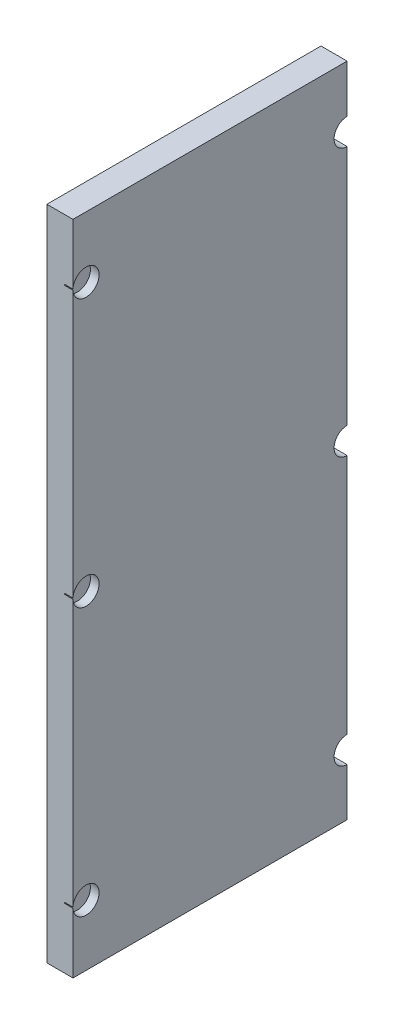
from build123d import *

# Parameters (mm, degrees)
SKETCH_1_W                                     = 3
SKETCH_1_H                                     = 74
EXTRUDE_1_DEPTH                                = 31.5
SKETCH_2_W                                     = 3
SKETCH_2_H                                     = 1.5
SIDE_REAR_EXTENSION_1P5MM_DEPTH                = 31.5
SKETCH_3_R                                     = 1.5
SIDE_TOP_EDGE_MAGNET_POCKETS_D3_DEPTH1_3_DEPTH = 1
SIDE_BOTTOM_EDGE_SEMICIRCLES_D3_THROUGH_DEPTH  = 4


with BuildPart() as part:
    # Эскиз1 → Бобышка-Вытянуть1 (new body)
    with BuildSketch(Plane.XY):
        with Locations((1.5, 37)):
            Rectangle(SKETCH_1_W, SKETCH_1_H)
    extrude(amount=EXTRUDE_1_DEPTH)

    # Эскиз2 → side_rear_extension_1p5mm (add)
    with BuildSketch(Plane.XY):
        with Locations((1.5, 74.75)):
            Rectangle(SKETCH_2_W, SKETCH_2_H)
    extrude(amount=SIDE_REAR_EXTENSION_1P5MM_DEPTH)

    # Эскиз3 → side_top_edge_magnet_pockets_D3_depth1_3x (cut)
    with BuildSketch(Plane(origin=(3, 0, 0), x_dir=(0, 0, -1), z_dir=(1, 0, 0))):
        with Locations((-30.001, 7)):
            Circle(SKETCH_3_R)
        with Locations((-30.001, 37.75)):
            Circle(SKETCH_3_R)
        with Locations((-30.001, 68.5)):
            Circle(SKETCH_3_R)
    extrude(amount=-SIDE_TOP_EDGE_MAGNET_POCKETS_D3_DEPTH1_3_DEPTH, mode=Mode.SUBTRACT)

    # Эскиз4 → side_bottom_edge_semicircles_D3_through_3x (cut)
    with BuildSketch(Plane.ZY):
        with BuildLine():
            Line((0, 5.5), (0, 8.5))
            ThreePointArc((0, 8.5), (1.5, 7), (0, 5.5))
        make_face()
        with BuildLine():
            Line((0, 36.25), (0, 39.25))
            ThreePointArc((0, 39.25), (1.5, 37.75), (0, 36.25))
        make_face()
        with BuildLine():
            Line((0, 67), (0, 70))
            ThreePointArc((0, 70), (1.5, 68.5), (0, 67))
        make_face()
    extrude(amount=-SIDE_BOTTOM_EDGE_SEMICIRCLES_D3_THROUGH_DEPTH, mode=Mode.SUBTRACT)


solid = part.part
